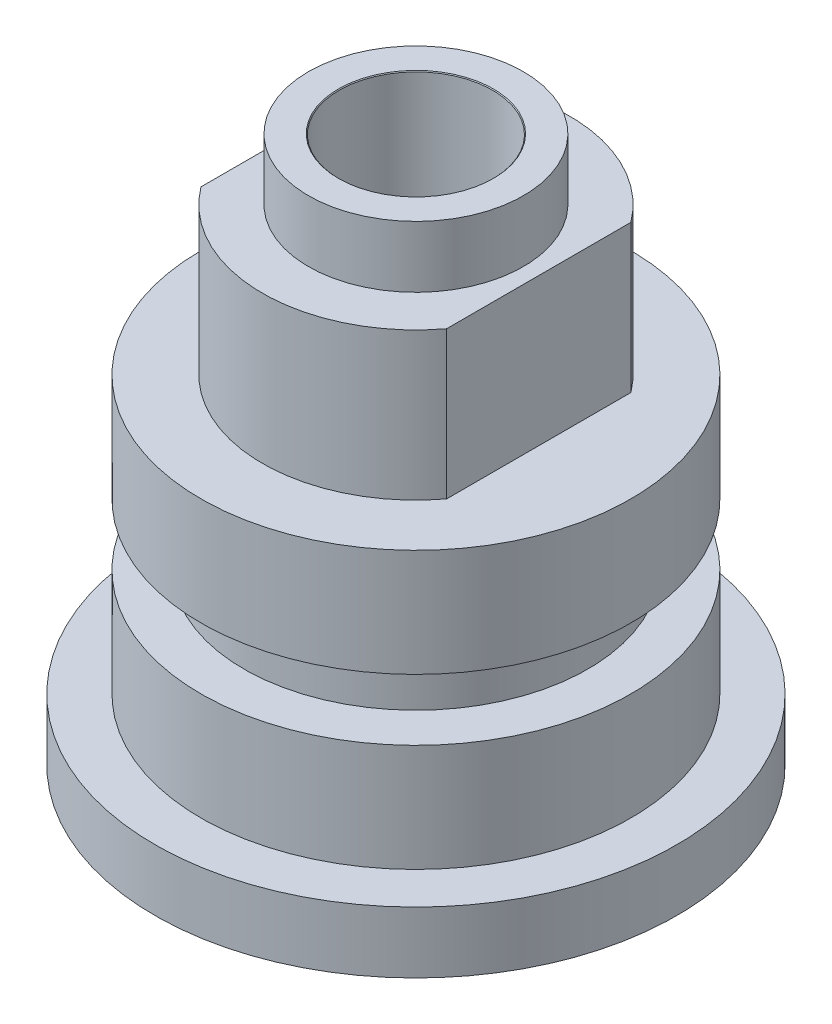
from build123d import *

# Parameters (mm, degrees)
CUT_EXTRUDE_1_DEPTH = 4.8
CUT_EXTRUDE_START   = -2
CUT_EXTRUDE_2_DEPTH = 2
MM_1_D              = 5
MM_1_DEPTH          = 5.497848452
MM_1_CSINK_D        = 5.05
MM_1_CSINK_ANGLE    = 90
MM_1_TIP            = 1.502151548


with BuildPart() as part:
    # 草图1 → 旋转1 (revolve)
    with BuildSketch(Plane.XY, mode=Mode.PRIVATE) as revolve_1_sk:
        Polygon((0, 0), (5, 0), (5, 2), (8.5, 2), (8.5, 4), (7, 4), (7, 7.5), (5.6, 7.5), (5.6, 9.5), (7, 9.5), (7, 13), (5, 13), (5, 17.8), (3.5, 17.8), (3.5, 19.8), (0, 19.8), align=None)
    revolve(revolve_1_sk.sketch.rotate(Axis((0, 19.8, 0), (0, -1, 0)), 180), axis=Axis((0, 19.8, 0), (0, -1, 0)))

    # 草图3 → 切除-拉伸1 (cut)
    with BuildSketch(Plane(origin=(0, 17.8, 0), x_dir=(1, 0, 0), z_dir=(0, 1, 0))):
        with BuildLine():
            Line((-4, 3), (-4, -3))
            ThreePointArc((-4, -3), (-5, 0), (-4, 3))
        make_face()
        with BuildLine():
            Line((4, 3), (4, -3))
            ThreePointArc((4, -3), (5, 0), (4, 3))
        make_face()
    extrude(amount=-CUT_EXTRUDE_1_DEPTH, mode=Mode.SUBTRACT)

    # 草图4 → 切除-拉伸2 (cut)
    with BuildSketch(Plane.XZ.offset(CUT_EXTRUDE_START)):
        with BuildLine():
            Line((-2.5, 4.330127019), (-2.5, -4.330127019))
            ThreePointArc((-2.5, -4.330127019), (-5, 0), (-2.5, 4.330127019))
        make_face()
        with BuildLine():
            Line((2.5, 4.330127019), (2.5, -4.330127019))
            ThreePointArc((2.5, -4.330127019), (5, 0), (2.5, 4.330127019))
        make_face()
    extrude(amount=CUT_EXTRUDE_2_DEPTH, mode=Mode.SUBTRACT)

    # 草图6 → 大小mm 暗销孔2 (revolve, cut)
    with BuildSketch(Plane(origin=(0, 0, 0), x_dir=(0, 0, -1), z_dir=(1, 0, 0))):
        Polygon((0, 0), (0, 2), (2, 0.798278762), (2, 0.025), (2.025, 0), align=None)
    revolve(axis=Axis((0, -6.35, 0), (0, 1, 0)), mode=Mode.SUBTRACT)

    # 大小mm 暗销孔1
    with Locations(Plane(origin=(0, 19.8, 0), x_dir=(1, 0, 0), z_dir=(0, 1, 0))):
        with Locations((0, 0)):
            CounterSinkHole(MM_1_D / 2, MM_1_CSINK_D / 2, depth=MM_1_DEPTH, counter_sink_angle=MM_1_CSINK_ANGLE)
            with Locations((0, 0, -(MM_1_DEPTH + MM_1_TIP / 2))):  # 118° drill point
                Cone(0, MM_1_D / 2, MM_1_TIP, mode=Mode.SUBTRACT)


solid = part.part
